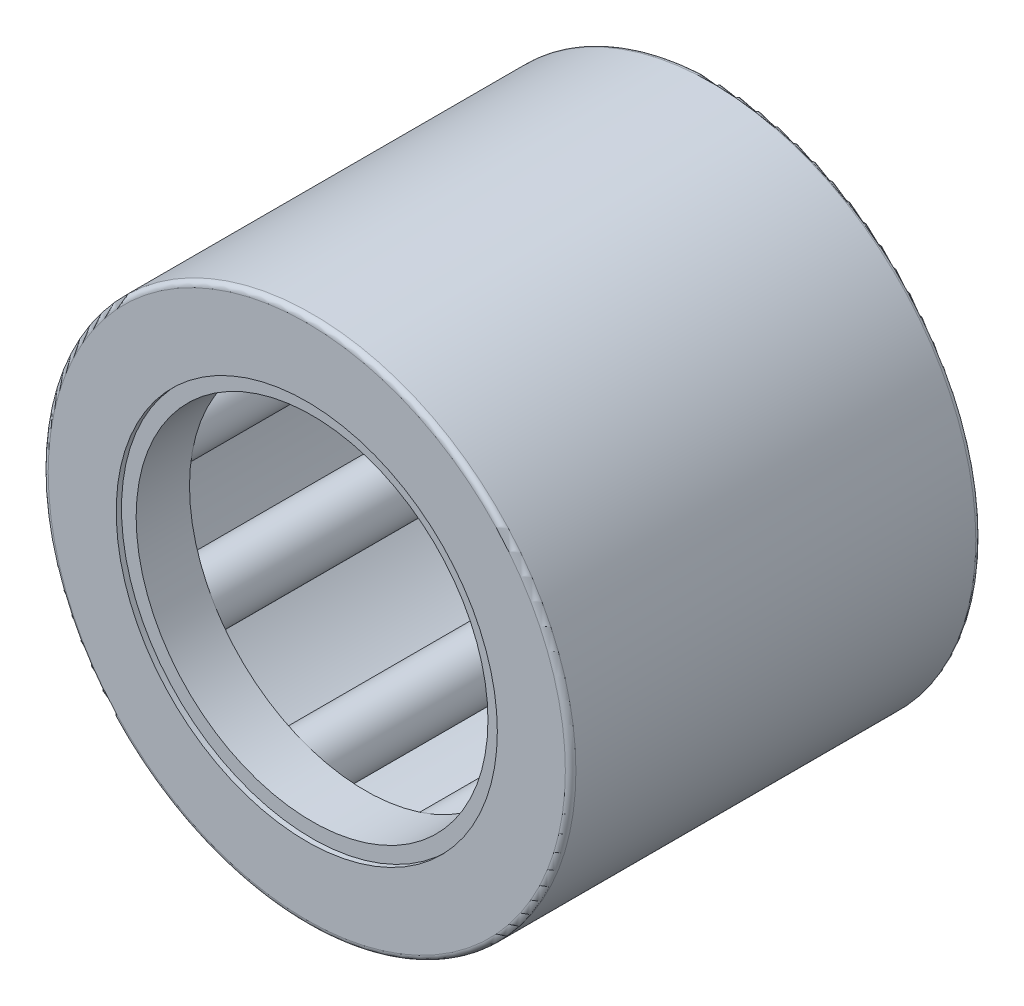
from build123d import *

# Parameters (mm, degrees)
SKETCH2_W         = 7.9375
SKETCH2_H         = 0.5953125
SKETCH3_W         = 9.525
SKETCH3_H         = 0.1984375
CIRPATTERN1_COUNT = 9
CIRPATTERN1_ANGLE = 320
FILLET1_R         = 0.142875
SKETCH4_W         = 1.444625
SKETCH4_H         = 0.396875
SKETCH5_W         = 1.444625
SKETCH5_H         = 0.396875


with BuildPart() as part:
    # Sketch1 → Revolve1 (revolve)
    with BuildSketch(Plane(origin=(0, 0, 0), x_dir=(0, 0, -1), z_dir=(1, 0, 0))):
        Polygon((-5.55625, 7.14375), (5.55625, 7.14375), (5.55625, 5.159375), (4.7625, 5.159375), (4.7625, 6.35), (-4.7625, 6.35), (-4.7625, 5.159375), (-5.55625, 5.159375), align=None)
    revolve(axis=Axis((0, 0, 5.55625), (0, 0, -1)))

    # Fillet1
    fillet1_edges = [part.edges().sort_by_distance(p)[0] for p in [
        (0, -7.14375, -5.55625),
        (0, -7.14375, 5.55625),
    ]]
    fillet(fillet1_edges, radius=FILLET1_R)


with BuildPart() as body_2:
    # Sketch2 → Revolve2 (revolve)
    with BuildSketch(Plane(origin=(0, 0, 0), x_dir=(0, 0, -1), z_dir=(1, 0, 0))):
        with Locations((0, 6.05234375)):
            Rectangle(SKETCH2_W, SKETCH2_H)
    revolve(axis=Axis((0, 5.55625, 3.96875), (0, 0, -1)))


with BuildPart() as body_3:
    # Sketch3 → Revolve3 (revolve)
    with BuildSketch(Plane(origin=(0, 0, 0), x_dir=(0, 0, -1), z_dir=(1, 0, 0))):
        with Locations((0, 5.65546875)):
            Rectangle(SKETCH3_W, SKETCH3_H)
    revolve(axis=Axis((0, 5.55625, 4.7625), (0, 0, -1)))


with BuildPart() as cirpattern1_1:
    # CirPattern1: pattern copy
    add(body_2.part.rotate(Axis((0, 0, -5.55625), (0, 0, 1)), 1 * CIRPATTERN1_ANGLE / (CIRPATTERN1_COUNT - 1)))


with BuildPart() as cirpattern1_2:
    # CirPattern1: pattern copy
    add(body_2.part.rotate(Axis((0, 0, -5.55625), (0, 0, 1)), 2 * CIRPATTERN1_ANGLE / (CIRPATTERN1_COUNT - 1)))


with BuildPart() as cirpattern1_3:
    # CirPattern1: pattern copy
    add(body_2.part.rotate(Axis((0, 0, -5.55625), (0, 0, 1)), 3 * CIRPATTERN1_ANGLE / (CIRPATTERN1_COUNT - 1)))


with BuildPart() as cirpattern1_4:
    # CirPattern1: pattern copy
    add(body_2.part.rotate(Axis((0, 0, -5.55625), (0, 0, 1)), 4 * CIRPATTERN1_ANGLE / (CIRPATTERN1_COUNT - 1)))


with BuildPart() as cirpattern1_5:
    # CirPattern1: pattern copy
    add(body_2.part.rotate(Axis((0, 0, -5.55625), (0, 0, 1)), 5 * CIRPATTERN1_ANGLE / (CIRPATTERN1_COUNT - 1)))


with BuildPart() as cirpattern1_6:
    # CirPattern1: pattern copy
    add(body_2.part.rotate(Axis((0, 0, -5.55625), (0, 0, 1)), 6 * CIRPATTERN1_ANGLE / (CIRPATTERN1_COUNT - 1)))


with BuildPart() as cirpattern1_7:
    # CirPattern1: pattern copy
    add(body_2.part.rotate(Axis((0, 0, -5.55625), (0, 0, 1)), 7 * CIRPATTERN1_ANGLE / (CIRPATTERN1_COUNT - 1)))


with BuildPart() as cirpattern1_8:
    # CirPattern1: pattern copy
    add(body_2.part.rotate(Axis((0, 0, -5.55625), (0, 0, 1)), 8 * CIRPATTERN1_ANGLE / (CIRPATTERN1_COUNT - 1)))


with BuildPart() as cirpattern1_9:
    # CirPattern1: pattern copy
    add(body_3.part.rotate(Axis((0, 0, -5.55625), (0, 0, 1)), 1 * CIRPATTERN1_ANGLE / (CIRPATTERN1_COUNT - 1)))


with BuildPart() as cirpattern1_10:
    # CirPattern1: pattern copy
    add(body_3.part.rotate(Axis((0, 0, -5.55625), (0, 0, 1)), 2 * CIRPATTERN1_ANGLE / (CIRPATTERN1_COUNT - 1)))


with BuildPart() as cirpattern1_11:
    # CirPattern1: pattern copy
    add(body_3.part.rotate(Axis((0, 0, -5.55625), (0, 0, 1)), 3 * CIRPATTERN1_ANGLE / (CIRPATTERN1_COUNT - 1)))


with BuildPart() as cirpattern1_12:
    # CirPattern1: pattern copy
    add(body_3.part.rotate(Axis((0, 0, -5.55625), (0, 0, 1)), 4 * CIRPATTERN1_ANGLE / (CIRPATTERN1_COUNT - 1)))


with BuildPart() as cirpattern1_13:
    # CirPattern1: pattern copy
    add(body_3.part.rotate(Axis((0, 0, -5.55625), (0, 0, 1)), 5 * CIRPATTERN1_ANGLE / (CIRPATTERN1_COUNT - 1)))


with BuildPart() as cirpattern1_14:
    # CirPattern1: pattern copy
    add(body_3.part.rotate(Axis((0, 0, -5.55625), (0, 0, 1)), 6 * CIRPATTERN1_ANGLE / (CIRPATTERN1_COUNT - 1)))


with BuildPart() as cirpattern1_15:
    # CirPattern1: pattern copy
    add(body_3.part.rotate(Axis((0, 0, -5.55625), (0, 0, 1)), 7 * CIRPATTERN1_ANGLE / (CIRPATTERN1_COUNT - 1)))


with BuildPart() as cirpattern1_16:
    # CirPattern1: pattern copy
    add(body_3.part.rotate(Axis((0, 0, -5.55625), (0, 0, 1)), 8 * CIRPATTERN1_ANGLE / (CIRPATTERN1_COUNT - 1)))


with BuildPart() as body_20:
    # Sketch4 → Revolve4 (revolve)
    with BuildSketch(Plane(origin=(0, 0, 0), x_dir=(0, 0, -1), z_dir=(1, 0, 0))):
        with Locations((4.6910625, 4.9609375)):
            Rectangle(SKETCH4_W, SKETCH4_H)
    revolve(axis=Axis((0, 0, 5.55625), (0, 0, -1)))


with BuildPart() as body_21:
    # Sketch5 → Revolve5 (revolve)
    with BuildSketch(Plane(origin=(0, 0, 0), x_dir=(0, 0, -1), z_dir=(1, 0, 0))):
        with Locations((-4.6910625, 4.9609375)):
            Rectangle(SKETCH5_W, SKETCH5_H)
    revolve(axis=Axis((0, 0, 5.55625), (0, 0, -1)))


solid = Compound([part.part, body_2.part, body_3.part, cirpattern1_1.part, cirpattern1_2.part, cirpattern1_3.part, cirpattern1_4.part, cirpattern1_5.part, cirpattern1_6.part, cirpattern1_7.part, cirpattern1_8.part, cirpattern1_9.part, cirpattern1_10.part, cirpattern1_11.part, cirpattern1_12.part, cirpattern1_13.part, cirpattern1_14.part, cirpattern1_15.part, cirpattern1_16.part, body_20.part, body_21.part])
